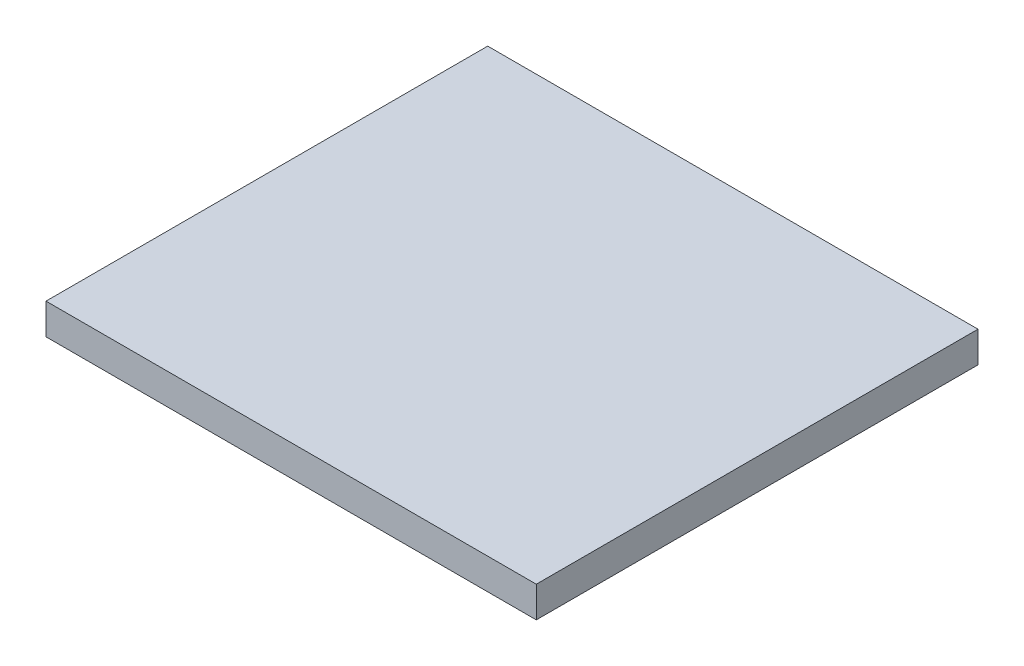
from build123d import *

# Parameters (mm, degrees)
SKETCH1_W           = 111
SKETCH1_H           = 100
BOSS_EXTRUDE1_DEPTH = 7


with BuildPart() as part:
    # Sketch1 → Boss-Extrude1 (new body)
    with BuildSketch(Plane(origin=(0, 0, 0), x_dir=(1, 0, 0), z_dir=(0, 1, 0))):
        with Locations((-25.475609756, -0.975609756)):
            Rectangle(SKETCH1_W, SKETCH1_H)
    extrude(amount=BOSS_EXTRUDE1_DEPTH)


solid = part.part
